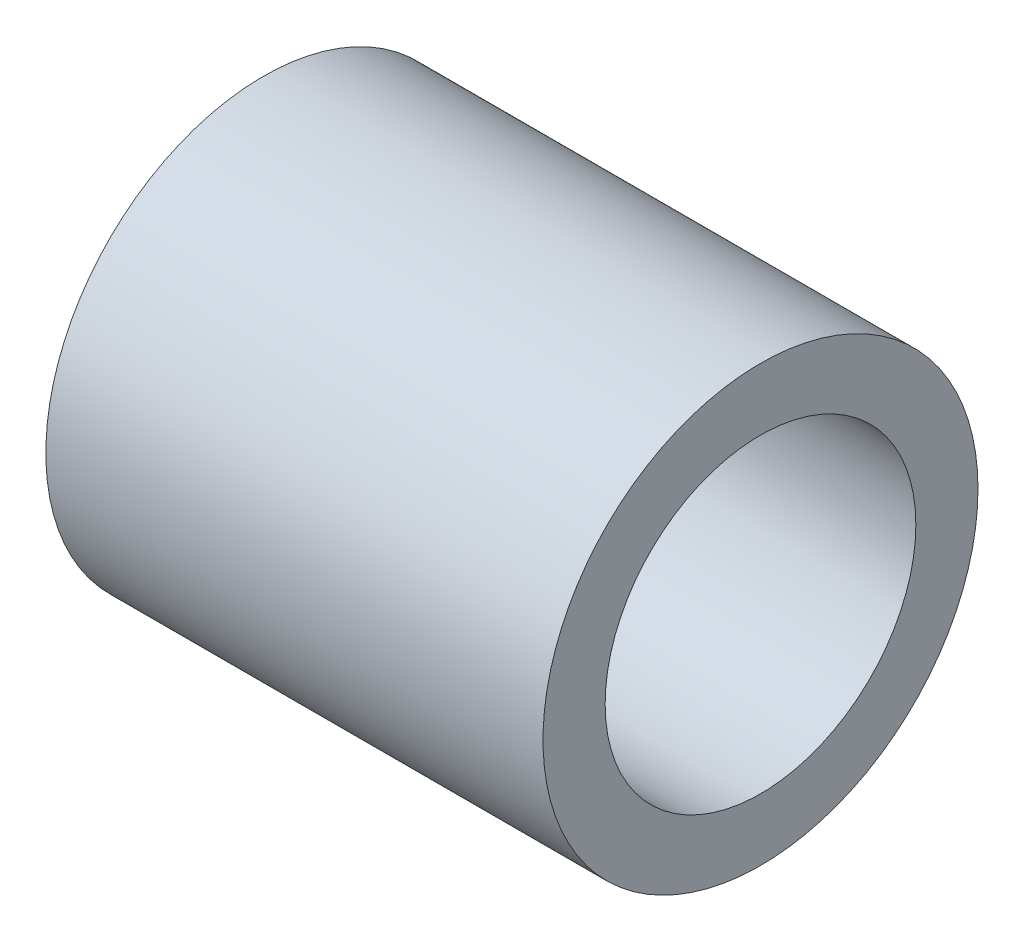
from build123d import *

# Parameters (mm, degrees)
SKETCH1_R           = 17.5
SKETCH1_R_2         = 12.5
BOSS_EXTRUDE1_DEPTH = 20


with BuildPart() as part:
    # Sketch1 → Boss-Extrude1 (new, symmetric)
    with BuildSketch(Plane(origin=(0, 0, 0), x_dir=(0, 0, -1), z_dir=(1, 0, 0))):
        Circle(SKETCH1_R)
        Circle(SKETCH1_R_2, mode=Mode.SUBTRACT)
    extrude(amount=BOSS_EXTRUDE1_DEPTH, both=True)


solid = part.part
